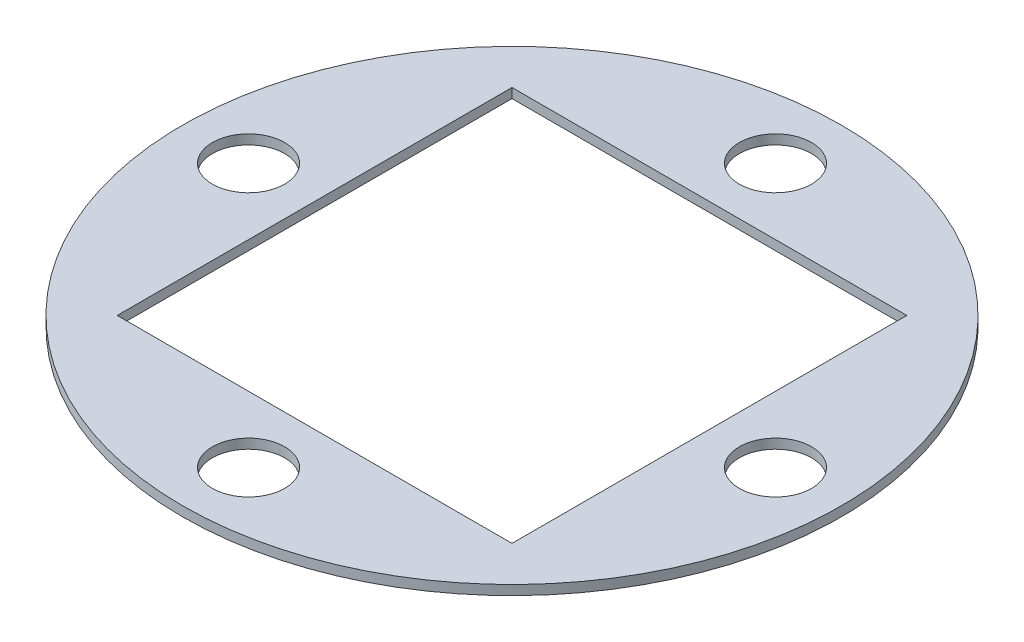
from build123d import *

# Parameters (mm, degrees)
SKETCH1_R           = 86.9315
BOSS_EXTRUDE1_DEPTH = 2.54
SKETCH2_W           = 104.14
SKETCH2_H           = 104.14
CUT_EXTRUDE1_DEPTH  = 2.54
SKETCH3_R           = 9.525
SKETCH3_W           = 104.14
SKETCH3_H           = 104.14
CUT_EXTRUDE3_DEPTH  = 203.2


with BuildPart() as part:
    # Sketch1 → Boss-Extrude1 (new body)
    with BuildSketch(Plane(origin=(0, 0, 0), x_dir=(1, 0, 0), z_dir=(0, 1, 0))):
        with Locations(Location((0, 0, 0), (0, 0, 270))):
            Circle(SKETCH1_R)
    extrude(amount=BOSS_EXTRUDE1_DEPTH)

    # Sketch2 → Cut-Extrude1 (cut)
    with BuildSketch(Plane(origin=(0, 2.54, 0), x_dir=(1, 0, 0), z_dir=(0, 1, 0))):
        Rectangle(SKETCH2_W, SKETCH2_H)
    extrude(amount=-CUT_EXTRUDE1_DEPTH, mode=Mode.SUBTRACT)

    # Sketch3 → Cut-Extrude3 (cut)
    with BuildSketch(Plane(origin=(0, 2.54, 0), x_dir=(1, 0, 0), z_dir=(0, 1, 0))):
        with Locations(Location((0, 69.50075, 0), (0, 0, 270))):
            Circle(SKETCH3_R)
        with Locations(Location((69.50075, 0, 0), (0, 0, 270))):
            Circle(SKETCH3_R)
        with Locations(Location((0, -69.50075, 0), (0, 0, 270))):
            Circle(SKETCH3_R)
        with Locations(Location((-69.50075, 0, 0), (0, 0, 270))):
            Circle(SKETCH3_R)
        Rectangle(SKETCH3_W, SKETCH3_H)
    extrude(amount=-CUT_EXTRUDE3_DEPTH, mode=Mode.SUBTRACT)


solid = part.part
